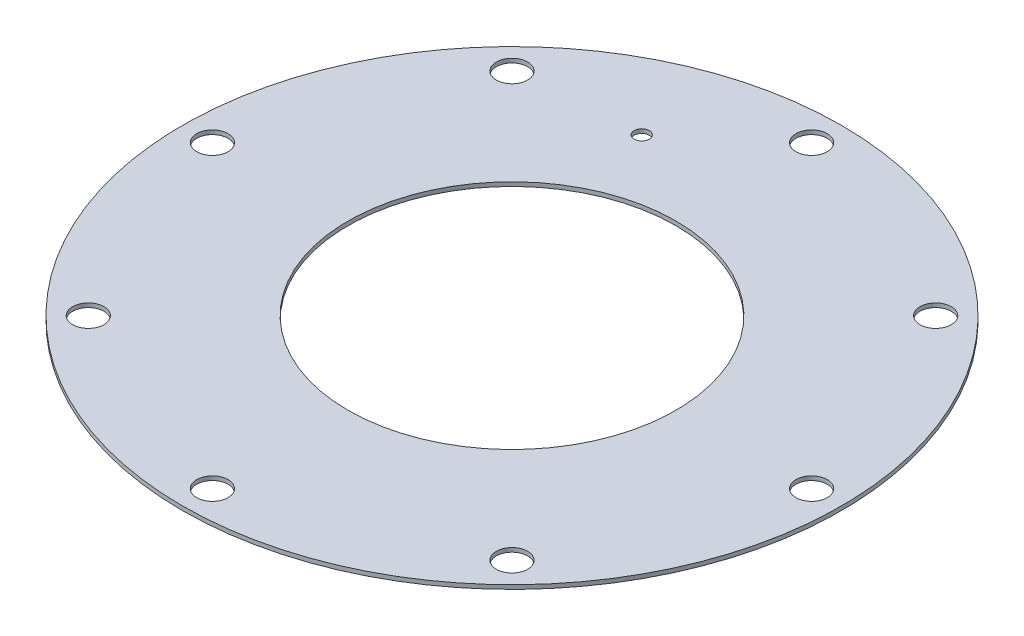
from build123d import *

# Parameters (mm, degrees)
SKETCH1_R           = 69.85
SKETCH1_R_2         = 34.7526
SKETCH1_R_3         = 3.3147
SKETCH1_R_4         = 1.5875
BOSS_EXTRUDE1_DEPTH = 0.8636


with BuildPart() as part:
    # Sketch1 → Boss-Extrude1 (new body)
    with BuildSketch(Plane(origin=(0, 0, 0), x_dir=(1, 0, 0), z_dir=(0, 1, 0))):
        with Locations(Location((0, 0, 0), (0, 0, 270))):
            Circle(SKETCH1_R)
        with Locations(Location((0, 0, 0), (0, 0, 270))):
            Circle(SKETCH1_R_2, mode=Mode.SUBTRACT)
        with Locations(Location((0, 63.5, 0), (0, 0, 270))):
            Circle(SKETCH1_R_3, mode=Mode.SUBTRACT)
        with Locations(Location((44.901280605, 44.901280605, 0), (0, 0, 270))):
            Circle(SKETCH1_R_3, mode=Mode.SUBTRACT)
        with Locations(Location((63.5, 0, 0), (0, 0, 270))):
            Circle(SKETCH1_R_3, mode=Mode.SUBTRACT)
        with Locations(Location((44.901280605, -44.901280605, 0), (0, 0, 270))):
            Circle(SKETCH1_R_3, mode=Mode.SUBTRACT)
        with Locations(Location((0, -63.5, 0), (0, 0, 270))):
            Circle(SKETCH1_R_3, mode=Mode.SUBTRACT)
        with Locations(Location((-44.901280605, -44.901280605, 0), (0, 0, 270))):
            Circle(SKETCH1_R_3, mode=Mode.SUBTRACT)
        with Locations(Location((-63.5, 0, 0), (0, 0, 270))):
            Circle(SKETCH1_R_3, mode=Mode.SUBTRACT)
        with Locations(Location((-44.901280605, 44.901280605, 0), (0, 0, 270))):
            Circle(SKETCH1_R_3, mode=Mode.SUBTRACT)
        with Locations(Location((-19.440318364, 46.933080252, 0), (0, 0, 270))):
            Circle(SKETCH1_R_4, mode=Mode.SUBTRACT)
    extrude(amount=BOSS_EXTRUDE1_DEPTH)


solid = part.part
